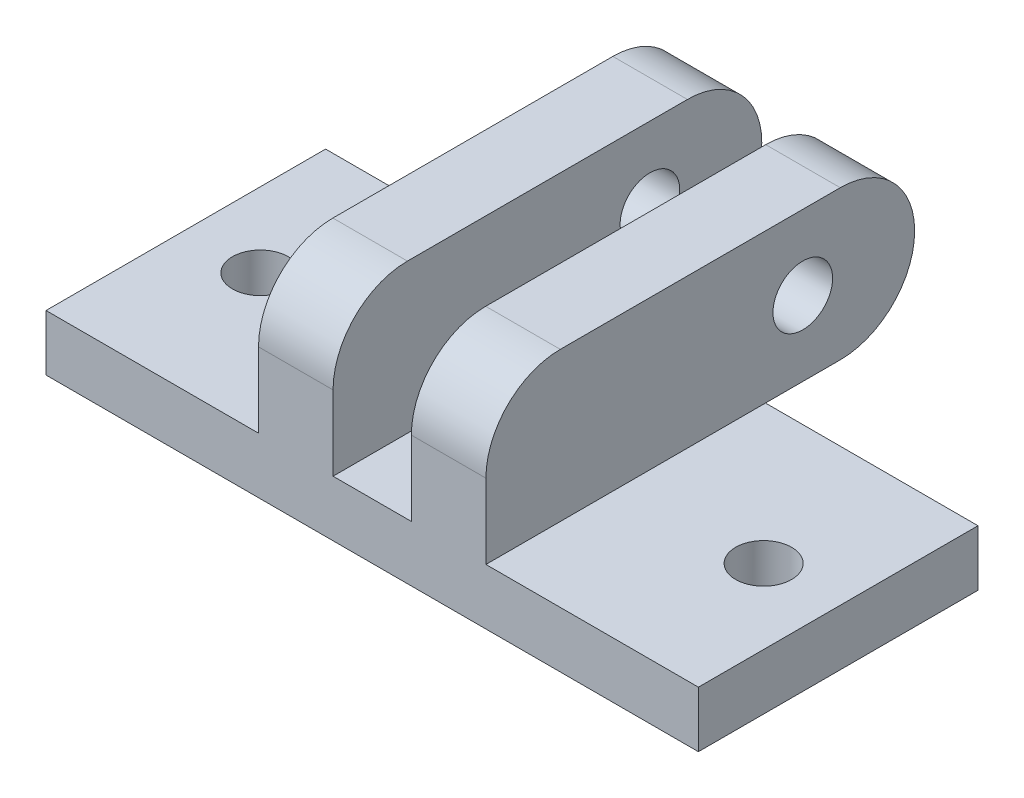
from build123d import *

# Parameters (mm, degrees)
SKETCH1_W           = 35
SKETCH1_H           = 15
BOSS_EXTRUDE1_DEPTH = 3
SKETCH2_W           = 4
SKETCH2_H           = 23
BOSS_EXTRUDE2_DEPTH = 8
SKETCH3_R           = 1.6
CUT_EXTRUDE1_DEPTH  = 8
CUT_EXTRUDE2_START  = -8
SKETCH5_R           = 1.6
CUT_EXTRUDE2_DEPTH  = 8
SKETCH6_R           = 1.5
CUT_EXTRUDE3_DEPTH  = 8


with BuildPart() as part:
    # Sketch1 → Boss-Extrude1 (new body)
    with BuildSketch(Plane(origin=(0, 0, 0), x_dir=(1, 0, 0), z_dir=(0, 1, 0))):
        Rectangle(SKETCH1_W, SKETCH1_H)
    extrude(amount=BOSS_EXTRUDE1_DEPTH)

    # Sketch2 → Boss-Extrude2 (add)
    with BuildSketch(Plane(origin=(0, 3, 0), x_dir=(1, 0, 0), z_dir=(0, 1, 0))):
        with Locations((-4.1, 4)):
            Rectangle(SKETCH2_W, SKETCH2_H)
        with Locations((4.1, 4)):
            Rectangle(SKETCH2_W, SKETCH2_H)
    extrude(amount=BOSS_EXTRUDE2_DEPTH)

    # Sketch3 → Cut-Extrude1 (cut)
    with BuildSketch(Plane.ZY.offset(6.1)):
        with Locations((-9.5, 7)):
            Circle(SKETCH3_R)
        with BuildLine():
            Line((-15.5, 6.99), (-15.5, 3))
            Line((-15.5, 3), (-11.51, 3))
            ThreePointArc((-11.51, 3), (-14.331356057, 4.168643943), (-15.5, 6.99))
        make_face()
        with BuildLine():
            Line((-15.5, 7.01), (-15.5, 11))
            Line((-15.5, 11), (-11.51, 11))
            ThreePointArc((-11.51, 11), (-14.331356057, 9.831356057), (-15.5, 7.01))
        make_face()
        with BuildLine():
            Line((7.5, 11), (7.5, 7.01))
            ThreePointArc((7.5, 7.01), (6.331356057, 9.831356057), (3.51, 11))
            Line((3.51, 11), (7.5, 11))
        make_face()
    extrude(amount=-CUT_EXTRUDE1_DEPTH, mode=Mode.SUBTRACT)

    # Sketch5 → Cut-Extrude2 (cut)
    with BuildSketch(Plane(origin=(6.1, 0, 0), x_dir=(0, 0, -1), z_dir=(1, 0, 0)).offset(CUT_EXTRUDE2_START)):
        with Locations(Location((9.5, 7, 0), (0, 0, 180))):
            Circle(SKETCH5_R)
        with BuildLine():
            Line((11.51, 11), (15.5, 11))
            Line((15.5, 11), (15.5, 7.01))
            ThreePointArc((15.5, 7.01), (14.331356057, 9.831356057), (11.51, 11))
        make_face()
        with BuildLine():
            Line((15.5, 6.99), (15.5, 3))
            Line((15.5, 3), (11.51, 3))
            ThreePointArc((11.51, 3), (14.331356057, 4.168643943), (15.5, 6.99))
        make_face()
        with BuildLine():
            Line((-7.5, 7.01), (-7.5, 11))
            Line((-7.5, 11), (-3.51, 11))
            ThreePointArc((-3.51, 11), (-6.331356057, 9.831356057), (-7.5, 7.01))
        make_face()
    extrude(amount=CUT_EXTRUDE2_DEPTH, mode=Mode.SUBTRACT)

    # Sketch6 → Cut-Extrude3 (cut)
    with BuildSketch(Plane(origin=(0, 3, 0), x_dir=(1, 0, 0), z_dir=(0, 1, 0))):
        with Locations(Location((13.5, 0, 0), (0, 0, 270))):
            Circle(SKETCH6_R)
        with Locations(Location((-13.5, 0, 0), (0, 0, 270))):
            Circle(SKETCH6_R)
    extrude(amount=-CUT_EXTRUDE3_DEPTH, mode=Mode.SUBTRACT)


solid = part.part
